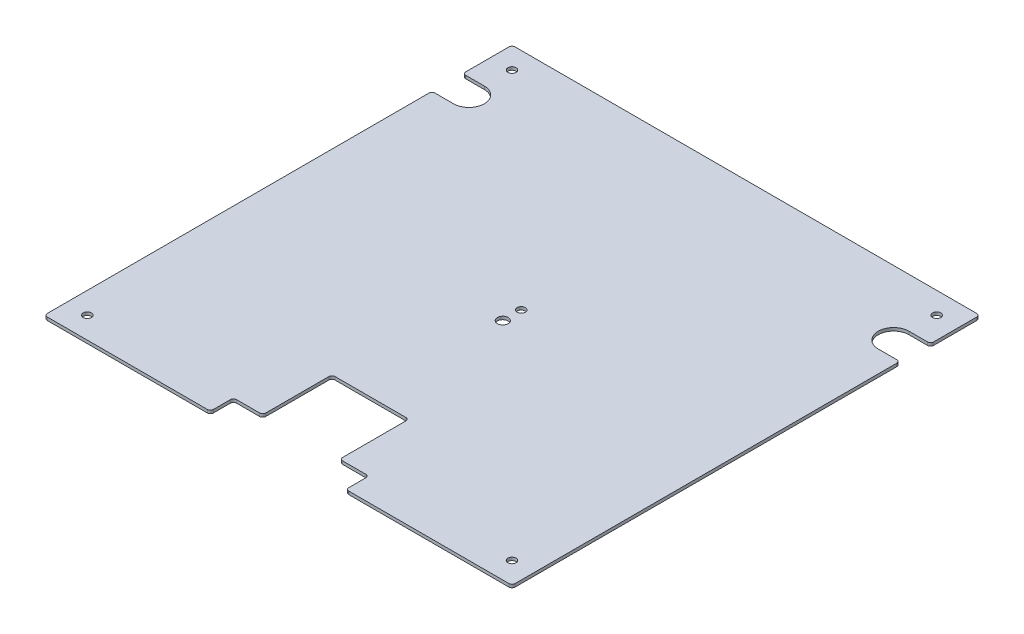
from build123d import *

# Parameters (mm, degrees)
SKETCH1_W                = 304
SKETCH1_H                = 304
BOSS_EXTRUDE1_DEPTH      = 2
SKETCH2_W                = 88
SKETCH2_H                = 15
CUT_EXTRUDE1_DEPTH       = 215.969765316
SKETCH7_W                = 50
SKETCH7_H                = 45
CUT_EXTRUDE2_DEPTH       = 2
FILLET1_R                = 2
F_7_0_7_DIAMETER_HOLE1_D = 7
M5_CLEARANCE_HOLE1_D     = 5.3


with BuildPart() as part:
    # Sketch1 → Boss-Extrude1 (new body)
    with BuildSketch(Plane(origin=(0, 0, 0), x_dir=(1, 0, 0), z_dir=(0, 1, 0))):
        Rectangle(SKETCH1_W, SKETCH1_H)
    extrude(amount=BOSS_EXTRUDE1_DEPTH)

    # Sketch2 → Cut-Extrude1 (cut, through all)
    with BuildSketch(Plane(origin=(0, 2, 0), x_dir=(1, 0, 0), z_dir=(0, 1, 0))):
        with Locations((0, -144.5)):
            Rectangle(SKETCH2_W, SKETCH2_H)
        with BuildLine():
            Line((-152, 100), (-138, 100))
            ThreePointArc((-138, 100), (-128, 110), (-138, 120))
            Line((-138, 120), (-152, 120))
            Line((-152, 120), (-152, 100))
        make_face()
        with BuildLine():
            Line((152, 100), (138, 100))
            ThreePointArc((138, 100), (128, 110), (138, 120))
            Line((138, 120), (152, 120))
            Line((152, 120), (152, 100))
        make_face()
    extrude(amount=-CUT_EXTRUDE1_DEPTH, mode=Mode.SUBTRACT)

    # Sketch7 → Cut-Extrude2 (cut)
    with BuildSketch(Plane.XZ):
        with Locations((0, 114.5)):
            Rectangle(SKETCH7_W, SKETCH7_H)
    extrude(amount=-CUT_EXTRUDE2_DEPTH, mode=Mode.SUBTRACT)

    # Fillet1
    fillet1_edges = [part.edges().sort_by_distance(p)[0] for p in [
        (44, 1, 152),
        (-44, 1, 152),
        (-44, 1, 137),
        (44, 1, 137),
        (-152, 1, -100),
        (-152, 1, -120),
        (152, 1, -120),
        (152, 1, -100),
        (25, 1, 92),
        (25, 1, 137),
        (-25, 1, 137),
        (-25, 1, 92),
        (-152, 1, -152),
        (152, 1, -152),
        (152, 1, 152),
        (-152, 1, 152),
    ]]
    fillet(fillet1_edges, radius=FILLET1_R)

    # Ø7.0 (7) Diameter Hole1 (through all)
    with Locations(Plane(origin=(0, 2, 0), x_dir=(1, 0, 0), z_dir=(0, 1, 0))):
        with Locations((0, -6)):
            Hole(F_7_0_7_DIAMETER_HOLE1_D / 2)

    # M5 Clearance Hole1 (through all)
    with Locations(Plane(origin=(0, 2, 0), x_dir=(1, 0, 0), z_dir=(0, 1, 0))):
        with Locations((-138, 138), (138, 138), (138, -138), (-138, -138), (0, 6)):
            Hole(M5_CLEARANCE_HOLE1_D / 2)


solid = part.part
